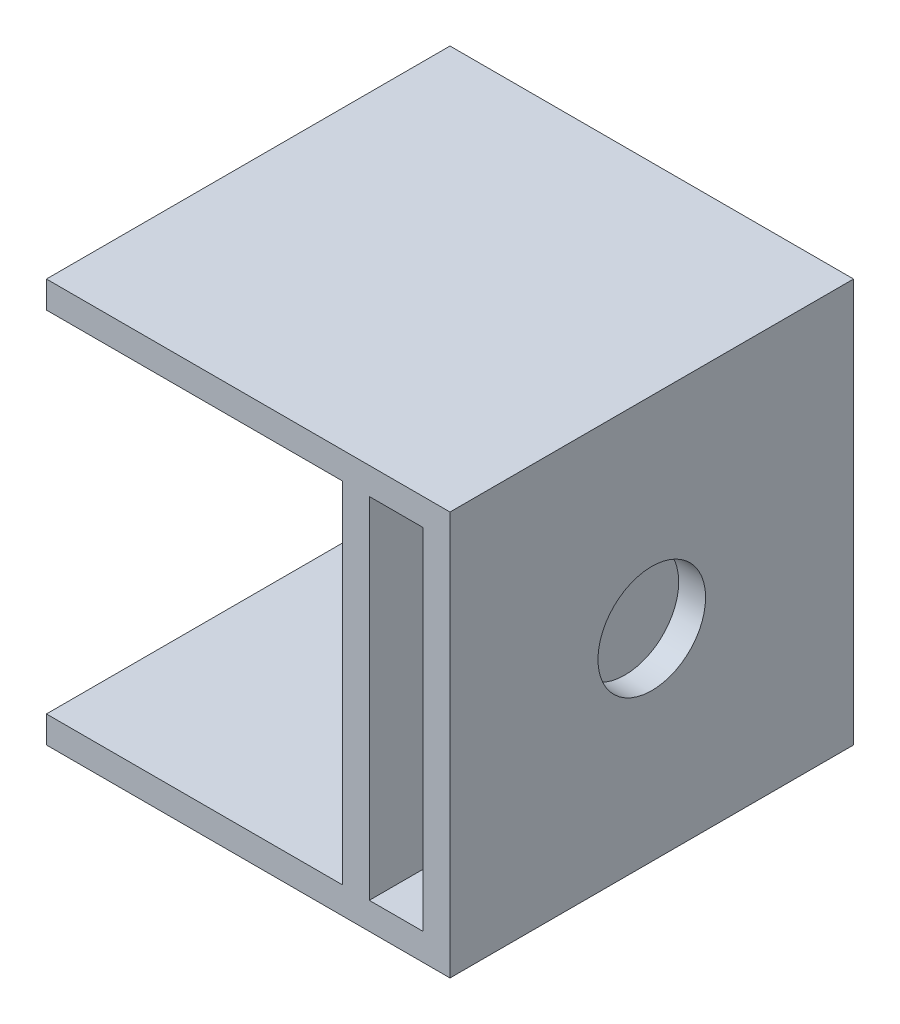
from build123d import *

# Parameters (mm, degrees)
SKETCH1_W           = 4
SKETCH1_H           = 26
BOSS_EXTRUDE1_DEPTH = 30
SKETCH2_R           = 4
CUT_EXTRUDE1_DEPTH  = 30


with BuildPart() as part:
    # Sketch1 → Boss-Extrude1 (new body)
    with BuildSketch(Plane.XY):
        Polygon((-17.861271676, 18.222543353), (12.138728324, 18.222543353), (12.138728324, -11.777456647), (-17.861271676, -11.777456647), (-17.861271676, -9.777456647), (4.138728324, -9.777456647), (4.138728324, 16.222543353), (-17.861271676, 16.222543353), align=None)
        with Locations((8.138728324, 3.222543353)):
            Rectangle(SKETCH1_W, SKETCH1_H, mode=Mode.SUBTRACT)
    extrude(amount=BOSS_EXTRUDE1_DEPTH)

    # Sketch2 → Cut-Extrude1 (cut)
    with BuildSketch(Plane(origin=(12.138728324, 0, 0), x_dir=(0, 0, -1), z_dir=(1, 0, 0))):
        with Locations((-15, 3.222543353)):
            Circle(SKETCH2_R)
    extrude(amount=-CUT_EXTRUDE1_DEPTH, mode=Mode.SUBTRACT)


solid = part.part
